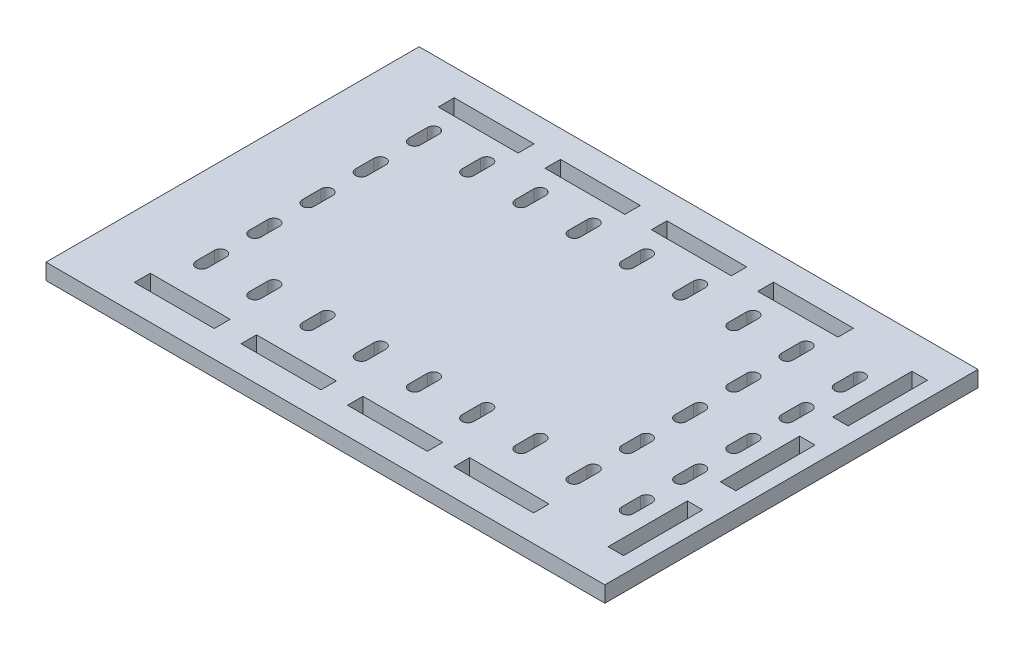
from build123d import *

# Parameters (mm, degrees)
SKETCH1_W           = 200
SKETCH1_H           = 140.2
BOSS_EXTRUDE1_DEPTH = 6
SKETCH2_W           = 5.8
SKETCH2_H           = 29.8
CUT_EXTRUDE1_DEPTH  = 6
SKETCH5_W           = 30
SKETCH5_H           = 6
SKETCH5_H_2         = 5.8
CUT_EXTRUDE3_DEPTH  = 6
CUT_EXTRUDE4_DEPTH  = 6
SKETCH7_W           = 140.2
SKETCH7_H           = 6
BOSS_EXTRUDE2_DEPTH = 10


with BuildPart() as part:
    # Sketch1 → Boss-Extrude1 (new body)
    with BuildSketch(Plane(origin=(0, 0, 0), x_dir=(1, 0, 0), z_dir=(0, 1, 0))):
        with Locations((100, 70.1)):
            Rectangle(SKETCH1_W, SKETCH1_H)
    extrude(amount=BOSS_EXTRUDE1_DEPTH)

    # Sketch2 → Cut-Extrude1 (cut)
    with BuildSketch(Plane(origin=(0, 6, 0), x_dir=(1, 0, 0), z_dir=(0, 1, 0))):
        with Locations((191.1, 112.3)):
            Rectangle(SKETCH2_W, SKETCH2_H)
        with Locations((191.1, 70.1)):
            Rectangle(SKETCH2_W, SKETCH2_H)
        with Locations((191.1, 27.9)):
            Rectangle(SKETCH2_W, SKETCH2_H)
    extrude(amount=-CUT_EXTRUDE1_DEPTH, mode=Mode.SUBTRACT)

    # Sketch5 → Cut-Extrude3 (cut)
    with BuildSketch(Plane(origin=(0, 6, 0), x_dir=(1, 0, 0), z_dir=(0, 1, 0))):
        with Locations((28.2, 127.2)):
            Rectangle(SKETCH5_W, SKETCH5_H)
        with Locations((68.2, 127.2)):
            Rectangle(SKETCH5_W, SKETCH5_H_2)
        with Locations((108.2, 127.2)):
            Rectangle(SKETCH5_W, SKETCH5_H_2)
        Polygon((163.2, 130.2), (133.2, 130.2), (133.2, 124.2), (163.2, 124.4), align=None)
        Polygon((133.2, 16), (163.2, 15.8), (163.2, 10), (133.2, 10), align=None)
        with Locations((108.2, 13)):
            Rectangle(SKETCH5_W, SKETCH5_H_2)
        with Locations((68.2, 13)):
            Rectangle(SKETCH5_W, SKETCH5_H_2)
        with Locations((28.2, 13)):
            Rectangle(SKETCH5_W, SKETCH5_H)
    extrude(amount=-CUT_EXTRUDE3_DEPTH, mode=Mode.SUBTRACT)

    # Sketch6 → Cut-Extrude4 (cut)
    with BuildSketch(Plane(origin=(0, 6, 0), x_dir=(1, 0, 0), z_dir=(0, 1, 0))):
        with BuildLine():
            Line((182.2, 68.531121861), (182.2, 75.531121861))
            ThreePointArc((182.2, 75.531121861), (179.999659708, 77.73112194), (177.8, 75.530441488))
            Line((177.8, 75.530441488), (177.8, 68.530441488))
            ThreePointArc((177.8, 68.530441488), (180.000340187, 66.330781674), (182.2, 68.531121861))
        make_face()
        with BuildLine():
            Line((162.2, 68.530441488), (162.2, 75.530441488))
            ThreePointArc((162.2, 75.530441488), (159.999999738, 77.730441225), (157.8, 75.530440963))
            Line((157.8, 75.530440963), (157.8, 68.530440501))
            ThreePointArc((157.8, 68.530440501), (160.000000493, 66.330440994), (162.2, 68.530441488))
        make_face()
        with BuildLine():
            Line((182.2, 48.531121861), (182.2, 55.531121861))
            ThreePointArc((182.2, 55.531121861), (179.999659708, 57.73112194), (177.8, 55.530441488))
            Line((177.8, 55.530441488), (177.8, 48.530441488))
            ThreePointArc((177.8, 48.530441488), (180.000340187, 46.330781674), (182.2, 48.531121861))
        make_face()
        with BuildLine():
            Line((162.2, 48.530441488), (162.2, 55.530441488))
            ThreePointArc((162.2, 55.530441488), (159.999999738, 57.730441225), (157.8, 55.530440963))
            Line((157.8, 55.530440963), (157.8, 48.530440501))
            ThreePointArc((157.8, 48.530440501), (160.000000493, 46.330440994), (162.2, 48.530441488))
        make_face()
        with BuildLine():
            Line((182.2, 88.531121861), (182.2, 95.531121861))
            ThreePointArc((182.2, 95.531121861), (179.999659708, 97.73112194), (177.8, 95.530441488))
            Line((177.8, 95.530441488), (177.8, 88.530441488))
            ThreePointArc((177.8, 88.530441488), (180.000340187, 86.330781674), (182.2, 88.531121861))
        make_face()
        with BuildLine():
            Line((182.2, 108.530954546), (182.2, 115.530954546))
            ThreePointArc((182.2, 115.530954546), (180.000167289, 117.730954565), (177.8, 115.531289176))
            Line((177.8, 115.531289176), (177.8, 108.531289176))
            ThreePointArc((177.8, 108.531289176), (179.999832685, 106.331121861), (182.2, 108.530954546))
        make_face()
        with BuildLine():
            Line((162.2, 108.530441225), (162.2, 115.530441225))
            ThreePointArc((162.2, 115.530441225), (159.999999869, 117.730441095), (157.8, 115.530440964))
            Line((157.8, 115.530440964), (157.8, 108.530440964))
            ThreePointArc((157.8, 108.530440964), (160.000000131, 106.330441225), (162.2, 108.530441225))
        make_face()
        with BuildLine():
            Line((162.2, 88.530441488), (162.2, 95.530441488))
            ThreePointArc((162.2, 95.530441488), (159.999999738, 97.730441225), (157.8, 95.530440963))
            Line((157.8, 95.530440963), (157.8, 88.530440501))
            ThreePointArc((157.8, 88.530440501), (160.000000493, 86.330440994), (162.2, 88.530441488))
        make_face()
        with BuildLine():
            Line((182.2, 28.531121861), (182.2, 35.531121861))
            ThreePointArc((182.2, 35.531121861), (179.999659708, 37.73112194), (177.8, 35.530441488))
            Line((177.8, 35.530441488), (177.8, 28.530441488))
            ThreePointArc((177.8, 28.530441488), (180.000340187, 26.330781674), (182.2, 28.531121861))
        make_face()
        with BuildLine():
            Line((162.2, 28.530441488), (162.2, 35.530441488))
            ThreePointArc((162.2, 35.530441488), (159.999999738, 37.730441225), (157.8, 35.530440963))
            Line((157.8, 35.530440963), (157.8, 28.530440501))
            ThreePointArc((157.8, 28.530440501), (160.000000493, 26.330440994), (162.2, 28.530441488))
        make_face()
        with BuildLine():
            Line((142.2, 108.530441225), (142.2, 115.530441225))
            ThreePointArc((142.2, 115.530441225), (139.999999869, 117.730441095), (137.8, 115.530440964))
            Line((137.8, 115.530440964), (137.8, 108.530440964))
            ThreePointArc((137.8, 108.530440964), (140.000000131, 106.330441225), (142.2, 108.530441225))
        make_face()
        with BuildLine():
            Line((142.2, 28.530441488), (142.2, 35.530441488))
            ThreePointArc((142.2, 35.530441488), (139.999999738, 37.730441225), (137.8, 35.530440963))
            Line((137.8, 35.530440963), (137.8, 28.530440501))
            ThreePointArc((137.8, 28.530440501), (140.000000493, 26.330440994), (142.2, 28.530441488))
        make_face()
        with BuildLine():
            Line((122.2, 108.530441225), (122.2, 115.530441225))
            ThreePointArc((122.2, 115.530441225), (119.999999869, 117.730441095), (117.8, 115.530440964))
            Line((117.8, 115.530440964), (117.8, 108.530440964))
            ThreePointArc((117.8, 108.530440964), (120.000000131, 106.330441225), (122.2, 108.530441225))
        make_face()
        with BuildLine():
            Line((122.2, 28.530441488), (122.2, 35.530441488))
            ThreePointArc((122.2, 35.530441488), (119.999999738, 37.730441225), (117.8, 35.530440963))
            Line((117.8, 35.530440963), (117.8, 28.530440501))
            ThreePointArc((117.8, 28.530440501), (120.000000493, 26.330440994), (122.2, 28.530441488))
        make_face()
        with BuildLine():
            Line((102.2, 108.530441225), (102.2, 115.530441225))
            ThreePointArc((102.2, 115.530441225), (99.999999869, 117.730441095), (97.8, 115.530440964))
            Line((97.8, 115.530440964), (97.8, 108.530440964))
            ThreePointArc((97.8, 108.530440964), (100.000000131, 106.330441225), (102.2, 108.530441225))
        make_face()
        with BuildLine():
            Line((102.2, 28.530441488), (102.2, 35.530441488))
            ThreePointArc((102.2, 35.530441488), (99.999999738, 37.730441225), (97.8, 35.530440963))
            Line((97.8, 35.530440963), (97.8, 28.530440501))
            ThreePointArc((97.8, 28.530440501), (100.000000493, 26.330440994), (102.2, 28.530441488))
        make_face()
        with BuildLine():
            Line((82.2, 108.530441225), (82.2, 115.530441225))
            ThreePointArc((82.2, 115.530441225), (79.999999869, 117.730441095), (77.8, 115.530440964))
            Line((77.8, 115.530440964), (77.8, 108.530440964))
            ThreePointArc((77.8, 108.530440964), (80.000000131, 106.330441225), (82.2, 108.530441225))
        make_face()
        with BuildLine():
            Line((82.2, 28.530441488), (82.2, 35.530441488))
            ThreePointArc((82.2, 35.530441488), (79.999999738, 37.730441225), (77.8, 35.530440963))
            Line((77.8, 35.530440963), (77.8, 28.530440501))
            ThreePointArc((77.8, 28.530440501), (80.000000493, 26.330440994), (82.2, 28.530441488))
        make_face()
        with BuildLine():
            Line((62.2, 108.530441225), (62.2, 115.530441225))
            ThreePointArc((62.2, 115.530441225), (59.999999869, 117.730441095), (57.8, 115.530440964))
            Line((57.8, 115.530440964), (57.8, 108.530440964))
            ThreePointArc((57.8, 108.530440964), (60.000000131, 106.330441225), (62.2, 108.530441225))
        make_face()
        with BuildLine():
            Line((62.2, 28.530441488), (62.2, 35.530441488))
            ThreePointArc((62.2, 35.530441488), (59.999999738, 37.730441225), (57.8, 35.530440963))
            Line((57.8, 35.530440963), (57.8, 28.530440501))
            ThreePointArc((57.8, 28.530440501), (60.000000493, 26.330440994), (62.2, 28.530441488))
        make_face()
        with BuildLine():
            Line((42.2, 108.530441225), (42.2, 115.530441225))
            ThreePointArc((42.2, 115.530441225), (39.999999869, 117.730441095), (37.8, 115.530440964))
            Line((37.8, 115.530440964), (37.8, 108.530440964))
            ThreePointArc((37.8, 108.530440964), (40.000000131, 106.330441225), (42.2, 108.530441225))
        make_face()
        with BuildLine():
            Line((42.2, 28.530441488), (42.2, 35.530441488))
            ThreePointArc((42.2, 35.530441488), (39.999999738, 37.730441225), (37.8, 35.530440963))
            Line((37.8, 35.530440963), (37.8, 28.530440501))
            ThreePointArc((37.8, 28.530440501), (40.000000493, 26.330440994), (42.2, 28.530441488))
        make_face()
        with BuildLine():
            Line((22.2, 68.530441488), (22.2, 75.530441488))
            ThreePointArc((22.2, 75.530441488), (19.999999738, 77.730441225), (17.8, 75.530440963))
            Line((17.8, 75.530440963), (17.8, 68.530440501))
            ThreePointArc((17.8, 68.530440501), (20.000000493, 66.330440994), (22.2, 68.530441488))
        make_face()
        with BuildLine():
            Line((22.2, 48.530441488), (22.2, 55.530441488))
            ThreePointArc((22.2, 55.530441488), (19.999999738, 57.730441225), (17.8, 55.530440963))
            Line((17.8, 55.530440963), (17.8, 48.530440501))
            ThreePointArc((17.8, 48.530440501), (20.000000493, 46.330440994), (22.2, 48.530441488))
        make_face()
        with BuildLine():
            Line((22.2, 108.530441225), (22.2, 115.530441225))
            ThreePointArc((22.2, 115.530441225), (19.999999869, 117.730441095), (17.8, 115.530440964))
            Line((17.8, 115.530440964), (17.8, 108.530440964))
            ThreePointArc((17.8, 108.530440964), (20.000000131, 106.330441225), (22.2, 108.530441225))
        make_face()
        with BuildLine():
            Line((22.2, 88.530441488), (22.2, 95.530441488))
            ThreePointArc((22.2, 95.530441488), (19.999999738, 97.730441225), (17.8, 95.530440963))
            Line((17.8, 95.530440963), (17.8, 88.530440501))
            ThreePointArc((17.8, 88.530440501), (20.000000493, 86.330440994), (22.2, 88.530441488))
        make_face()
        with BuildLine():
            Line((22.2, 28.530441488), (22.2, 35.530441488))
            ThreePointArc((22.2, 35.530441488), (19.999999738, 37.730441225), (17.8, 35.530440963))
            Line((17.8, 35.530440963), (17.8, 28.530440501))
            ThreePointArc((17.8, 28.530440501), (20.000000493, 26.330440994), (22.2, 28.530441488))
        make_face()
    extrude(amount=-CUT_EXTRUDE4_DEPTH, mode=Mode.SUBTRACT)

    # Sketch7 → Boss-Extrude2 (add)
    with BuildSketch(Plane.ZY):
        with Locations((-70.1, 3)):
            Rectangle(SKETCH7_W, SKETCH7_H)
    extrude(amount=BOSS_EXTRUDE2_DEPTH)


solid = part.part
